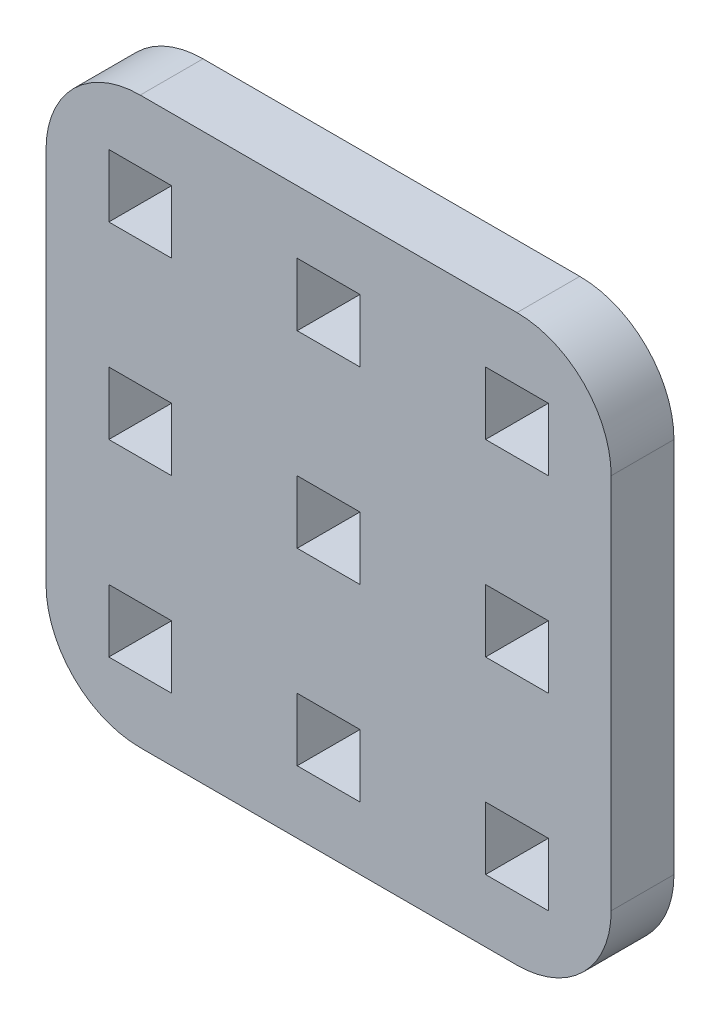
from build123d import *

# Parameters (mm, degrees)
MODEL_W                 = 3
MODEL_H                 = 3
SALIENTE_EXTRUIR1_DEPTH = 3


with BuildPart() as part:
    # Model → Saliente-Extruir1 (new body)
    with BuildSketch(Plane.XY):
        with BuildLine():
            Line((12.895467255, 298.259658236), (30.895467255, 298.259658236))
            ThreePointArc((30.895467255, 298.259658236), (34.077447771, 296.941638751), (35.395467255, 293.759658236))
            Line((35.395467255, 293.759658236), (35.395467255, 275.759658236))
            ThreePointArc((35.395467255, 275.759658236), (34.077447771, 272.577677721), (30.895467255, 271.259658236))
            Line((30.895467255, 271.259658236), (12.895467255, 271.259658236))
            ThreePointArc((12.895467255, 271.259658236), (9.71348674, 272.577677721), (8.395467255, 275.759658236))
            Line((8.395467255, 275.759658236), (8.395467255, 293.759658236))
            ThreePointArc((8.395467255, 293.759658236), (9.71348674, 296.941638751), (12.895467255, 298.259658236))
        make_face()
        with Locations((12.895467255, 293.759658236)):
            Rectangle(MODEL_W, MODEL_H, mode=Mode.SUBTRACT)
        with Locations((21.895467255, 293.759658236)):
            Rectangle(MODEL_W, MODEL_H, mode=Mode.SUBTRACT)
        with Locations((30.895467255, 293.759658236)):
            Rectangle(MODEL_W, MODEL_H, mode=Mode.SUBTRACT)
        with Locations((12.895467255, 275.759658236)):
            Rectangle(MODEL_W, MODEL_H, mode=Mode.SUBTRACT)
        with Locations((21.895467255, 275.759658236)):
            Rectangle(MODEL_W, MODEL_H, mode=Mode.SUBTRACT)
        with Locations((30.895467255, 275.759658236)):
            Rectangle(MODEL_W, MODEL_H, mode=Mode.SUBTRACT)
        with Locations((12.895467255, 284.759658236)):
            Rectangle(MODEL_W, MODEL_H, mode=Mode.SUBTRACT)
        with Locations((21.895467255, 284.759658236)):
            Rectangle(MODEL_W, MODEL_H, mode=Mode.SUBTRACT)
        with Locations((30.895467255, 284.759658236)):
            Rectangle(MODEL_W, MODEL_H, mode=Mode.SUBTRACT)
    extrude(amount=SALIENTE_EXTRUIR1_DEPTH)


solid = part.part
